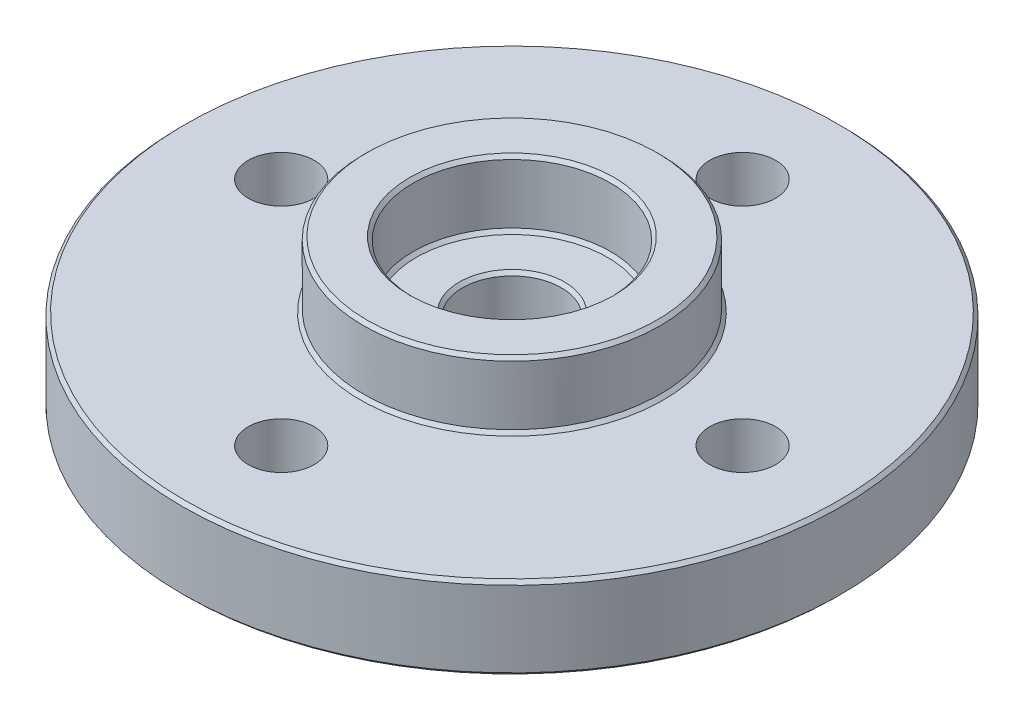
from build123d import *

# Parameters (mm, degrees)
SKETCH_1_R      = 10
SKETCH_1_R_2    = 1.5
SKETCH_1_R_3    = 1
EXTRUDE_1_DEPTH = 2.5
SKETCH_2_R      = 4.5
SKETCH_2_R_2    = 3
EXTRUDE_2_DEPTH = 2
CHAMFER_1_SIZE  = 0.1
CHAMFER_2_SIZE  = 0.1


with BuildPart() as part:
    # 草图1 → 凸台-拉伸1 (new body)
    with BuildSketch(Plane(origin=(0, 0, 0), x_dir=(1, 0, 0), z_dir=(0, 1, 0))):
        with Locations(Location((0, 0, 0), (0, 0, 270))):
            Circle(SKETCH_1_R)
        with Locations(Location((0, 0, 0), (0, 0, 270))):
            Circle(SKETCH_1_R_2, mode=Mode.SUBTRACT)
        with Locations(Location((0, 7, 0), (0, 0, 270))):
            Circle(SKETCH_1_R_3, mode=Mode.SUBTRACT)
        with Locations(Location((7, 0, 0), (0, 0, 270))):
            Circle(SKETCH_1_R_3, mode=Mode.SUBTRACT)
        with Locations(Location((0, -7, 0), (0, 0, 270))):
            Circle(SKETCH_1_R_3, mode=Mode.SUBTRACT)
        with Locations(Location((-7, 0, 0), (0, 0, 270))):
            Circle(SKETCH_1_R_3, mode=Mode.SUBTRACT)
    extrude(amount=EXTRUDE_1_DEPTH)

    # 草图2 → 凸台-拉伸2 (add)
    with BuildSketch(Plane(origin=(0, 2.5, 0), x_dir=(1, 0, 0), z_dir=(0, 1, 0))):
        with Locations(Location((0, 0, 0), (0, 0, 270))):
            Circle(SKETCH_2_R)
        with Locations(Location((0, 0, 0), (0, 0, 270))):
            Circle(SKETCH_2_R_2, mode=Mode.SUBTRACT)
    extrude(amount=EXTRUDE_2_DEPTH)

    # 倒角1
    chamfer_1_edges = [part.edges().sort_by_distance(p)[0] for p in [
        (0, 4.5, -4.5),
    ]]
    chamfer(chamfer_1_edges, length=CHAMFER_1_SIZE)

    # 倒角2
    chamfer_2_edges = [part.edges().sort_by_distance(p)[0] for p in [
        (0, 0, -10),
        (0, 2.5, -4.5),
        (0, 2.5, -3),
        (0, 4.5, -3),
        (0, 2.5, -10),
        (0, 2.5, -1.5),
    ]]
    chamfer(chamfer_2_edges, length=CHAMFER_2_SIZE)


solid = part.part
